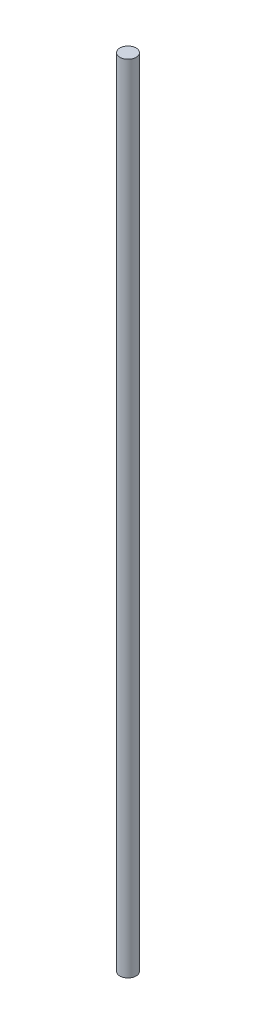
from build123d import *

# Parameters (mm, degrees)
SKETCH1_R           = 4
BOSS_EXTRUDE1_DEPTH = 392


with BuildPart() as part:
    # Sketch1 → Boss-Extrude1 (new body)
    with BuildSketch(Plane(origin=(0, 0, 0), x_dir=(1, 0, 0), z_dir=(0, 1, 0))):
        with Locations(Location((0, 0, 0), (0, 0, 270))):
            Circle(SKETCH1_R)
    extrude(amount=BOSS_EXTRUDE1_DEPTH)


solid = part.part
